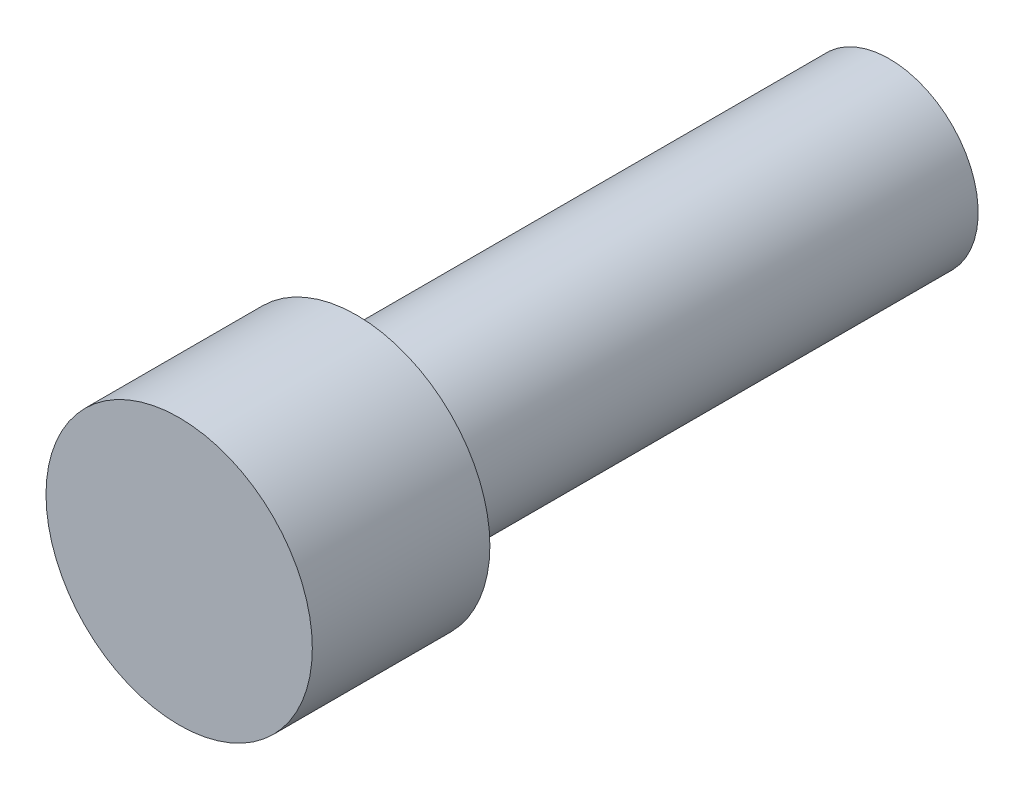
from build123d import *

# Parameters (mm, degrees)
SKETCH_1_R      = 1.5
EXTRUDE_1_DEPTH = 2
SKETCH_2_R      = 1
EXTRUDE_3_DEPTH = 6


with BuildPart() as part:
    # 草图1 → 凸台-拉伸1 (new body)
    with BuildSketch(Plane.XY):
        Circle(SKETCH_1_R)
    extrude(amount=EXTRUDE_1_DEPTH)

    # 草图2 → 凸台-拉伸3 (add)
    with BuildSketch(Plane(origin=(0, 0, 0), x_dir=(-1, 0, 0), z_dir=(0, 0, -1))):
        Circle(SKETCH_2_R)
    extrude(amount=EXTRUDE_3_DEPTH)


solid = part.part
